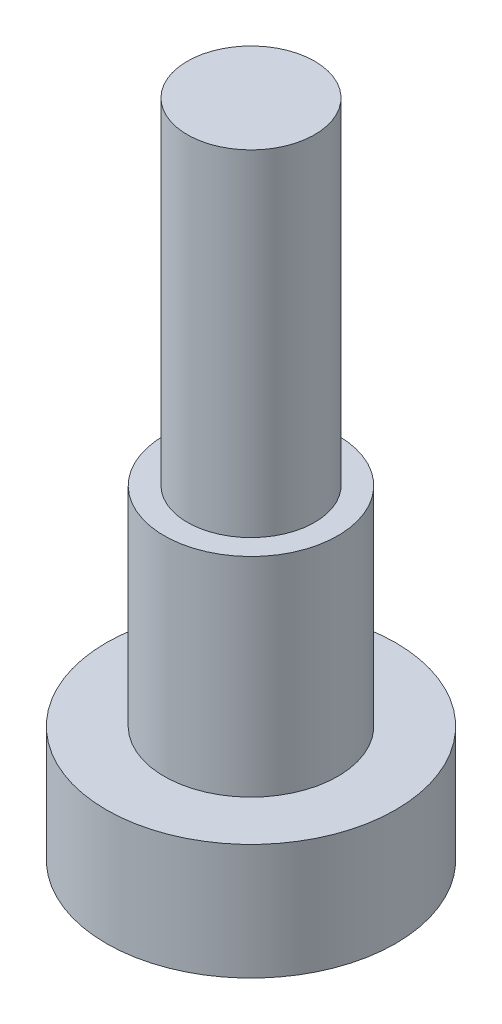
from build123d import *

# Parameters (mm, degrees)
ESQUISSE1_R        = 5.5
BOSS_EXTRU_1_DEPTH = 29
ESQUISSE2_R        = 7.5
BOSS_EXTRU_2_DEPTH = 18
ESQUISSE3_R        = 12.5
BOSS_EXTRU_3_DEPTH = 10


with BuildPart() as part:
    # Esquisse1 → Boss.-Extru.1 (new body)
    with BuildSketch(Plane(origin=(0, 0, 0), x_dir=(1, 0, 0), z_dir=(0, 1, 0))):
        with Locations(Location((0, 0, 0), (0, 0, 90))):
            Circle(ESQUISSE1_R)
    extrude(amount=BOSS_EXTRU_1_DEPTH)

    # Esquisse2 → Boss.-Extru.2 (add)
    with BuildSketch(Plane.XZ):
        with Locations(Location((0, 0, 0), (0, 0, 270))):
            Circle(ESQUISSE2_R)
    extrude(amount=BOSS_EXTRU_2_DEPTH)

    # Esquisse3 → Boss.-Extru.3 (add)
    with BuildSketch(Plane.XZ.offset(18)):
        with Locations(Location((0, 0, 0), (0, 0, 270))):
            Circle(ESQUISSE3_R)
    extrude(amount=BOSS_EXTRU_3_DEPTH)


solid = part.part
